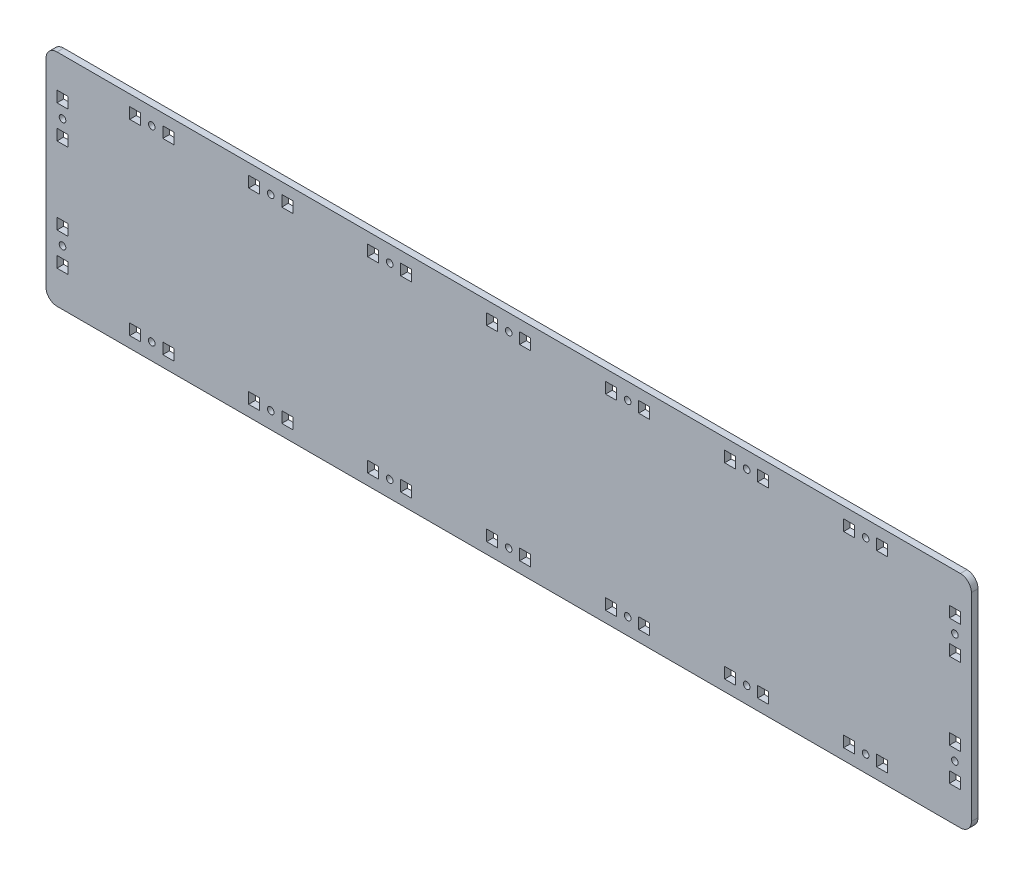
from build123d import *

# Parameters (mm, degrees)
SKETCH1_W           = 420
SKETCH1_H           = 100
SKETCH1_R           = 1.5
SKETCH1_W_2         = 5
SKETCH1_H_2         = 5
BOSS_EXTRUDE1_DEPTH = 3
FILLET1_R           = 5


with BuildPart() as part:
    # Sketch1 → Boss-Extrude1 (new body)
    with BuildSketch(Plane.XY):
        Rectangle(SKETCH1_W, SKETCH1_H)
        with Locations((0, -42.5)):
            Circle(SKETCH1_R, mode=Mode.SUBTRACT)
        with Locations((-54, -42.5)):
            Circle(SKETCH1_R, mode=Mode.SUBTRACT)
        with Locations((-108, -42.5)):
            Circle(SKETCH1_R, mode=Mode.SUBTRACT)
        with Locations((-162, -42.5)):
            Circle(SKETCH1_R, mode=Mode.SUBTRACT)
        with Locations((-202.5, 25)):
            Circle(SKETCH1_R, mode=Mode.SUBTRACT)
        with Locations(Location((54, -42.5, 0), (0, 0, 180))):
            Circle(SKETCH1_R, mode=Mode.SUBTRACT)
        with Locations(Location((108, -42.5, 0), (0, 0, 180))):
            Circle(SKETCH1_R, mode=Mode.SUBTRACT)
        with Locations(Location((162, -42.5, 0), (0, 0, 180))):
            Circle(SKETCH1_R, mode=Mode.SUBTRACT)
        with Locations(Location((-54, 42.5, 0), (0, 0, 90))):
            Circle(SKETCH1_R, mode=Mode.SUBTRACT)
        with Locations((162, 42.5)):
            Circle(SKETCH1_R, mode=Mode.SUBTRACT)
        with Locations(Location((-108, 42.5, 0), (0, 0, 90))):
            Circle(SKETCH1_R, mode=Mode.SUBTRACT)
        with Locations(Location((0, 42.5, 0), (0, 0, 90))):
            Circle(SKETCH1_R, mode=Mode.SUBTRACT)
        with Locations(Location((-162, 42.5, 0), (0, 0, 90))):
            Circle(SKETCH1_R, mode=Mode.SUBTRACT)
        with Locations((54, 42.5)):
            Circle(SKETCH1_R, mode=Mode.SUBTRACT)
        with Locations((108, 42.5)):
            Circle(SKETCH1_R, mode=Mode.SUBTRACT)
        with Locations(Location((-202.5, -25, 0), (0, 0, 90))):
            Circle(SKETCH1_R, mode=Mode.SUBTRACT)
        with Locations(Location((202.5, 25, 0), (0, 0, 180))):
            Circle(SKETCH1_R, mode=Mode.SUBTRACT)
        with Locations((202.5, -25)):
            Circle(SKETCH1_R, mode=Mode.SUBTRACT)
        with Locations((-7.5, -42.5)):
            Rectangle(SKETCH1_W_2, SKETCH1_H_2, mode=Mode.SUBTRACT)
        with Locations((7.5, -42.5)):
            Rectangle(SKETCH1_W_2, SKETCH1_H_2, mode=Mode.SUBTRACT)
        with Locations((-61.5, -42.5)):
            Rectangle(SKETCH1_W_2, SKETCH1_H_2, mode=Mode.SUBTRACT)
        with Locations((-46.5, -42.5)):
            Rectangle(SKETCH1_W_2, SKETCH1_H_2, mode=Mode.SUBTRACT)
        with Locations((-115.5, -42.5)):
            Rectangle(SKETCH1_W_2, SKETCH1_H_2, mode=Mode.SUBTRACT)
        with Locations((-100.5, -42.5)):
            Rectangle(SKETCH1_W_2, SKETCH1_H_2, mode=Mode.SUBTRACT)
        with Locations((-169.5, -42.5)):
            Rectangle(SKETCH1_W_2, SKETCH1_H_2, mode=Mode.SUBTRACT)
        with Locations((-154.5, -42.5)):
            Rectangle(SKETCH1_W_2, SKETCH1_H_2, mode=Mode.SUBTRACT)
        with Locations((-202.5, 17.5)):
            Rectangle(SKETCH1_W_2, SKETCH1_H_2, mode=Mode.SUBTRACT)
        with Locations((-202.5, 32.5)):
            Rectangle(SKETCH1_W_2, SKETCH1_H_2, mode=Mode.SUBTRACT)
        with Locations((61.5, -42.5)):
            Rectangle(SKETCH1_W_2, SKETCH1_H_2, mode=Mode.SUBTRACT)
        with Locations((46.5, -42.5)):
            Rectangle(SKETCH1_W_2, SKETCH1_H_2, mode=Mode.SUBTRACT)
        with Locations((115.5, -42.5)):
            Rectangle(SKETCH1_W_2, SKETCH1_H_2, mode=Mode.SUBTRACT)
        with Locations((100.5, -42.5)):
            Rectangle(SKETCH1_W_2, SKETCH1_H_2, mode=Mode.SUBTRACT)
        with Locations((169.5, -42.5)):
            Rectangle(SKETCH1_W_2, SKETCH1_H_2, mode=Mode.SUBTRACT)
        with Locations((154.5, -42.5)):
            Rectangle(SKETCH1_W_2, SKETCH1_H_2, mode=Mode.SUBTRACT)
        with Locations((-61.5, 42.5)):
            Rectangle(SKETCH1_W_2, SKETCH1_H_2, mode=Mode.SUBTRACT)
        with Locations((-46.5, 42.5)):
            Rectangle(SKETCH1_W_2, SKETCH1_H_2, mode=Mode.SUBTRACT)
        with Locations((169.5, 42.5)):
            Rectangle(SKETCH1_W_2, SKETCH1_H_2, mode=Mode.SUBTRACT)
        with Locations((154.5, 42.5)):
            Rectangle(SKETCH1_W_2, SKETCH1_H_2, mode=Mode.SUBTRACT)
        with Locations((-115.5, 42.5)):
            Rectangle(SKETCH1_W_2, SKETCH1_H_2, mode=Mode.SUBTRACT)
        with Locations((-100.5, 42.5)):
            Rectangle(SKETCH1_W_2, SKETCH1_H_2, mode=Mode.SUBTRACT)
        with Locations((-7.5, 42.5)):
            Rectangle(SKETCH1_W_2, SKETCH1_H_2, mode=Mode.SUBTRACT)
        with Locations((7.5, 42.5)):
            Rectangle(SKETCH1_W_2, SKETCH1_H_2, mode=Mode.SUBTRACT)
        with Locations((-169.5, 42.5)):
            Rectangle(SKETCH1_W_2, SKETCH1_H_2, mode=Mode.SUBTRACT)
        with Locations((-154.5, 42.5)):
            Rectangle(SKETCH1_W_2, SKETCH1_H_2, mode=Mode.SUBTRACT)
        with Locations((61.5, 42.5)):
            Rectangle(SKETCH1_W_2, SKETCH1_H_2, mode=Mode.SUBTRACT)
        with Locations((46.5, 42.5)):
            Rectangle(SKETCH1_W_2, SKETCH1_H_2, mode=Mode.SUBTRACT)
        with Locations((115.5, 42.5)):
            Rectangle(SKETCH1_W_2, SKETCH1_H_2, mode=Mode.SUBTRACT)
        with Locations((100.5, 42.5)):
            Rectangle(SKETCH1_W_2, SKETCH1_H_2, mode=Mode.SUBTRACT)
        with Locations((-202.5, -17.5)):
            Rectangle(SKETCH1_W_2, SKETCH1_H_2, mode=Mode.SUBTRACT)
        with Locations((-202.5, -32.5)):
            Rectangle(SKETCH1_W_2, SKETCH1_H_2, mode=Mode.SUBTRACT)
        with Locations((202.5, 17.5)):
            Rectangle(SKETCH1_W_2, SKETCH1_H_2, mode=Mode.SUBTRACT)
        with Locations((202.5, 32.5)):
            Rectangle(SKETCH1_W_2, SKETCH1_H_2, mode=Mode.SUBTRACT)
        with Locations((202.5, -17.5)):
            Rectangle(SKETCH1_W_2, SKETCH1_H_2, mode=Mode.SUBTRACT)
        with Locations((202.5, -32.5)):
            Rectangle(SKETCH1_W_2, SKETCH1_H_2, mode=Mode.SUBTRACT)
    extrude(amount=BOSS_EXTRUDE1_DEPTH)

    # Fillet1
    fillet1_edges = [part.edges().sort_by_distance(p)[0] for p in [
        (210, -50, 1.5),
        (-210, -50, 1.5),
        (-210, 50, 1.5),
        (210, 50, 1.5),
    ]]
    fillet(fillet1_edges, radius=FILLET1_R)


solid = part.part
